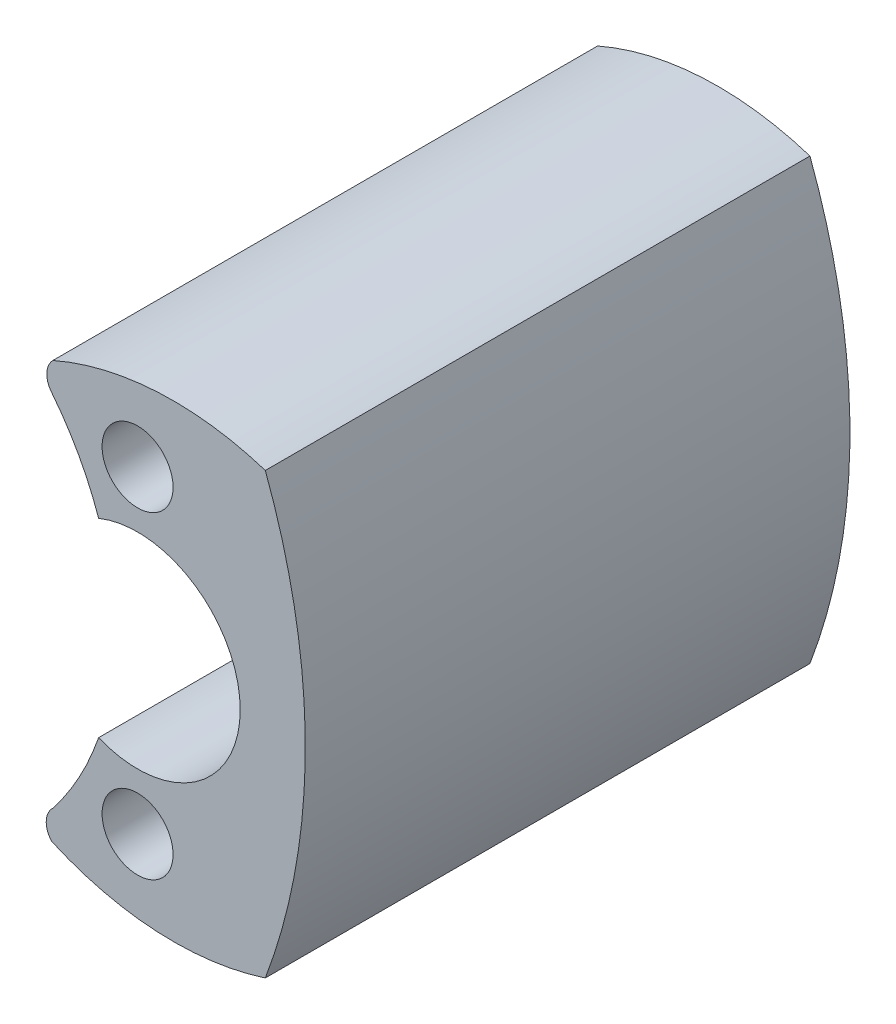
from build123d import *

# Parameters (mm, degrees)
EXTRUDE1_DEPTH      = 23
EXTRUDE1_DEPTH_BACK = 0.001
SKETCH3_R           = 1.5
CUT_EXTRUDE1_DEPTH  = 27.020417719
SKETCH5_R           = 4.335
CUT_EXTRUDE2_DEPTH  = 24


with BuildPart() as part:
    # Sketch1 → Extrude1 (new, two sides: drawn at the far end of the back side and taken through both)
    with BuildSketch(Plane.XY.offset(-EXTRUDE1_DEPTH_BACK)):
        with BuildLine():
            ThreePointArc((5.394294709, 9.281673418), (7.083207262, 0), (5.394294709, -9.281673418))
            ThreePointArc((5.394294709, -9.281673418), (0.839593343, -9.873480825), (-3.625620963, -8.797654747))
            ThreePointArc((-3.625620963, -8.797654747), (-3.857898862, -8.166383103), (-3.57576768, -7.555761366))
            ThreePointArc((-3.57576768, -7.555761366), (-0.970954643, 0.05080099), (-3.638712866, 7.635516404))
            ThreePointArc((-3.638712866, 7.635516404), (-3.831936153, 8.239573474), (-3.57576768, 8.819744049))
            ThreePointArc((-3.57576768, 8.819744049), (0.866819678, 9.874912356), (5.394294709, 9.281673418))
        make_face()
    extrude(amount=EXTRUDE1_DEPTH + EXTRUDE1_DEPTH_BACK)

    # Sketch3 → Cut-Extrude1 (cut, through all)
    with BuildSketch(Plane.XY.offset(23)):
        with Locations((0, 6.715)):
            Circle(SKETCH3_R)
        with Locations(Location((0, -6.715, 0), (0, 0, 180))):
            Circle(SKETCH3_R)
    extrude(amount=-CUT_EXTRUDE1_DEPTH, mode=Mode.SUBTRACT)

    # Sketch5 → Cut-Extrude2 (cut)
    with BuildSketch(Plane(origin=(0, 0, -0.001), x_dir=(-1, 0, 0), z_dir=(0, 0, -1))):
        Circle(SKETCH5_R)
    extrude(amount=-CUT_EXTRUDE2_DEPTH, mode=Mode.SUBTRACT)


solid = part.part
